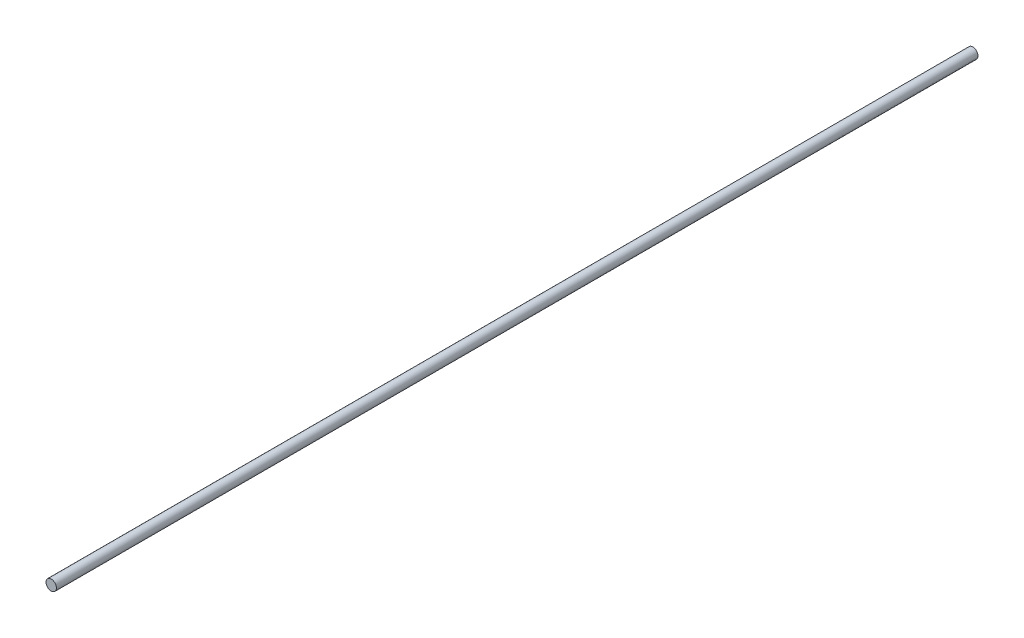
from build123d import *

# Parameters (mm, degrees)
SKETCH1_R           = 6.35
BOSS_EXTRUDE1_DEPTH = 1122.172


with BuildPart() as part:
    # Sketch1 → Boss-Extrude1 (new body)
    with BuildSketch(Plane.XY):
        with Locations((0, 0.045085855)):
            Circle(SKETCH1_R)
    extrude(amount=BOSS_EXTRUDE1_DEPTH)


solid = part.part
